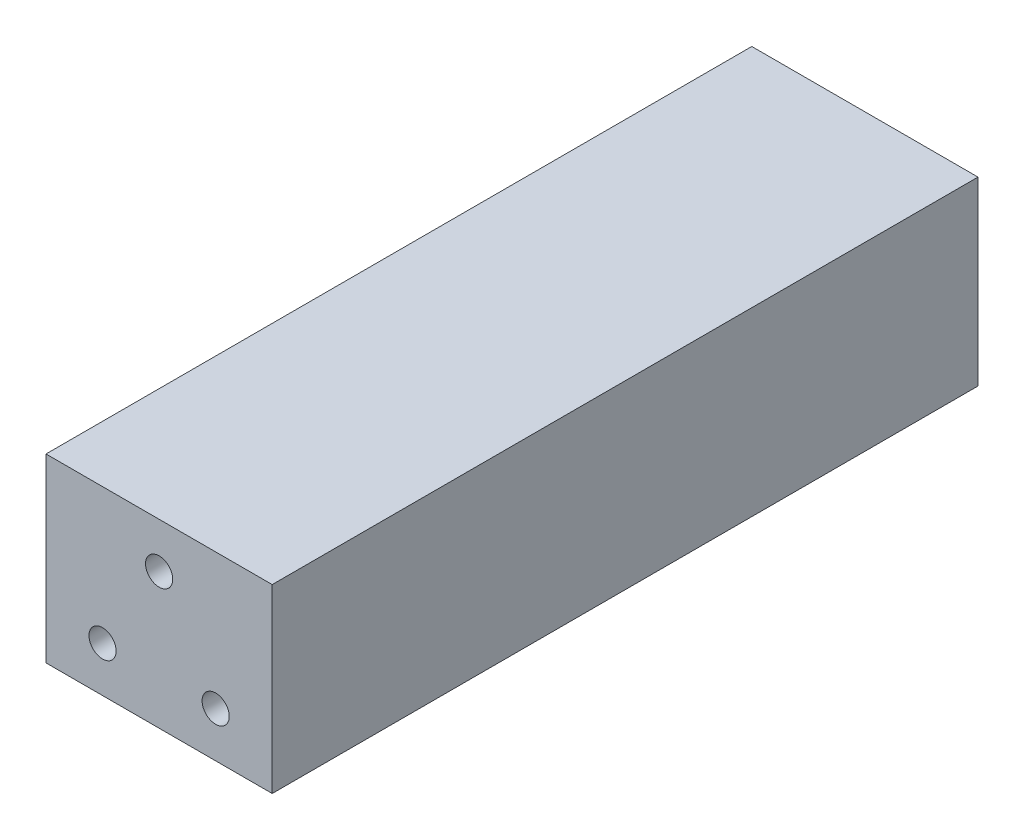
from build123d import *

# Parameters (mm, degrees)
SKETCH1_W           = 25
SKETCH1_H           = 20
BOSS_EXTRUDE2_DEPTH = 78
SKETCH3_R           = 1.5
CUT_EXTRUDE2_DEPTH  = 10
SKETCH6_R           = 1.485523147
SKETCH6_R_2         = 1.547360616
SKETCH6_R_3         = 1.494600316
CUT_EXTRUDE3_DEPTH  = 10


with BuildPart() as part:
    # Sketch1 → Boss-Extrude2 (new body)
    with BuildSketch(Plane.XY):
        with Locations((12.5, -10)):
            Rectangle(SKETCH1_W, SKETCH1_H)
    extrude(amount=BOSS_EXTRUDE2_DEPTH)

    # Sketch3 → Cut-Extrude2 (cut)
    with BuildSketch(Plane.XY.offset(78)):
        with Locations((6.25, -15)):
            Circle(SKETCH3_R)
        with Locations((12.5, -5)):
            Circle(SKETCH3_R)
        with Locations((18.75, -15)):
            Circle(SKETCH3_R)
    extrude(amount=-CUT_EXTRUDE2_DEPTH, mode=Mode.SUBTRACT)

    # Sketch6 → Cut-Extrude3 (cut)
    with BuildSketch(Plane(origin=(0, 0, 0), x_dir=(-1, 0, 0), z_dir=(0, 0, -1))):
        with Locations((-12.5, -5)):
            Circle(SKETCH6_R)
        with Locations((-6.25, -15)):
            Circle(SKETCH6_R_2)
        with Locations((-18.75, -15)):
            Circle(SKETCH6_R_3)
    extrude(amount=-CUT_EXTRUDE3_DEPTH, mode=Mode.SUBTRACT)


solid = part.part
